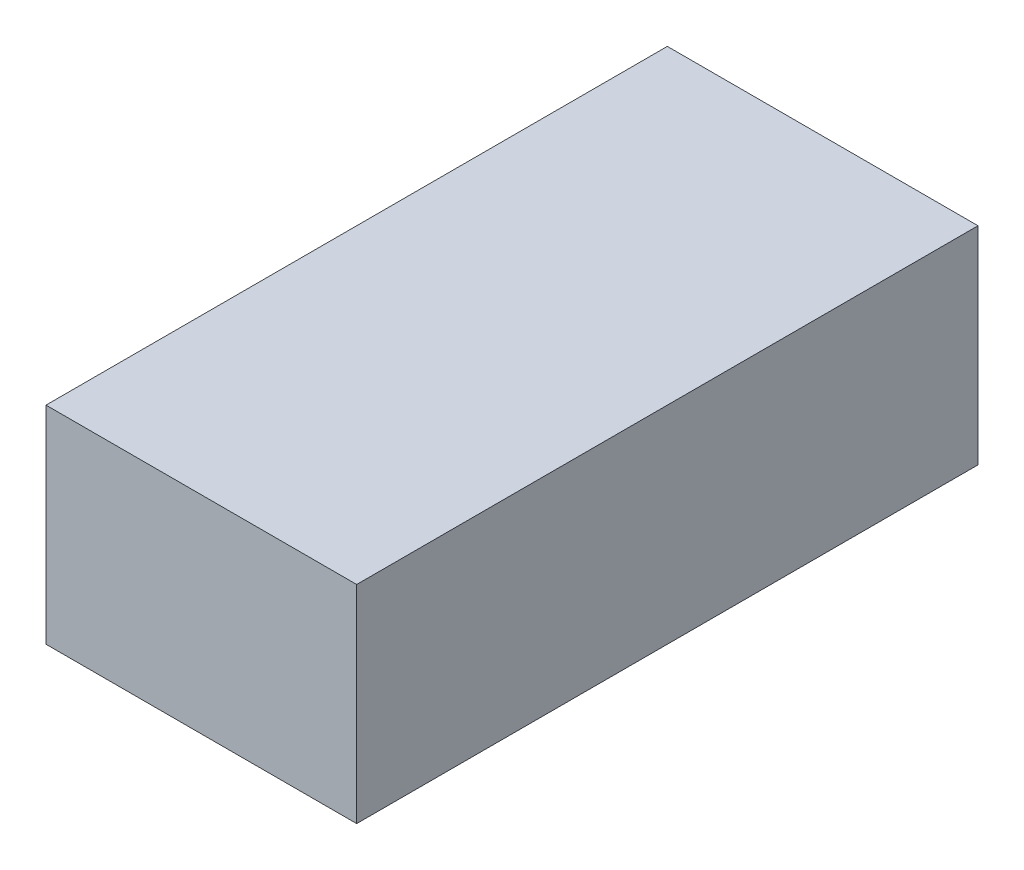
from build123d import *

# Parameters (mm, degrees)
ESQUISSE1_W        = 90
ESQUISSE1_H        = 180
BOSS_EXTRU_1_DEPTH = 60


with BuildPart() as part:
    # Esquisse1 → Boss.-Extru.1 (new body)
    with BuildSketch(Plane(origin=(0, 0, 0), x_dir=(1, 0, 0), z_dir=(0, 1, 0))):
        with Locations((-20.720930233, 1.674418605)):
            Rectangle(ESQUISSE1_W, ESQUISSE1_H)
    extrude(amount=BOSS_EXTRU_1_DEPTH)


solid = part.part
